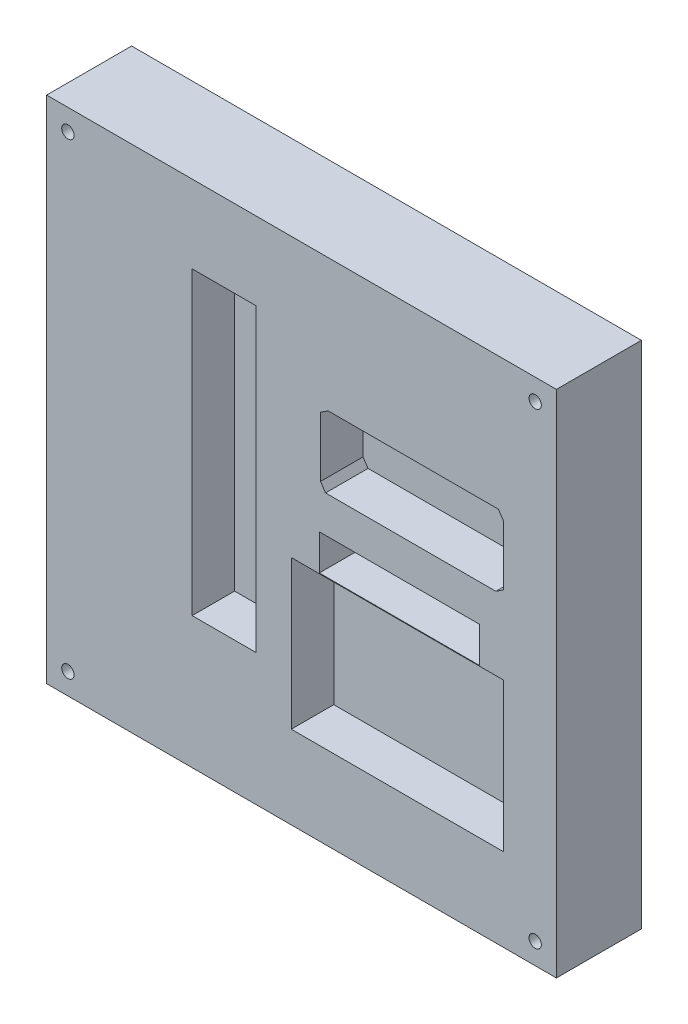
from build123d import *

# Parameters (mm, degrees)
SKETCH1_W           = 120
SKETCH1_H           = 120
BOSS_EXTRUDE1_DEPTH = 3
SKETCH1_3_W         = 120
SKETCH1_3_H         = 120
SKETCH1_3_R         = 1.45
SKETCH1_3_W_2       = 100
SKETCH1_3_H_2       = 100
BOSS_EXTRUDE2_DEPTH = 10
BOSS_EXTRUDE3_START = 10
SKETCH5_W           = 120
SKETCH5_H           = 120
SKETCH5_R           = 1.45
SKETCH5_W_2         = 70.699570221
SKETCH5_H_2         = 15
SKETCH5_W_3         = 35
SKETCH5_H_3         = 50
SKETCH5_W_4         = 8.3907815
SKETCH5_H_4         = 37.710608616
BOSS_EXTRUDE3_DEPTH = 10


with BuildPart() as part:
    # Sketch1 → Boss-Extrude1 (new body)
    with BuildSketch(Plane(origin=(0, 0, 0), x_dir=(0, 1, 0), z_dir=(0, 0, 1))):
        Rectangle(SKETCH1_W, SKETCH1_H)
    extrude(amount=BOSS_EXTRUDE1_DEPTH)

    # Sketch1<3> → Boss-Extrude2 (add)
    # profile 1 of 3: a face of its own
    with BuildSketch(Plane(origin=(0, 0, 0), x_dir=(0, 1, 0), z_dir=(0, 0, 1))):
        Rectangle(SKETCH1_3_W, SKETCH1_3_H)
        with Locations(Location((-55, -55, 0), (0, 0, 270))):
            Circle(SKETCH1_3_R, mode=Mode.SUBTRACT)
        with Locations(Location((-55, 55, 0), (0, 0, 90))):
            Circle(SKETCH1_3_R, mode=Mode.SUBTRACT)
        with Locations(Location((55, -55, 0), (0, 0, 90))):
            Circle(SKETCH1_3_R, mode=Mode.SUBTRACT)
        with Locations(Location((55, 55, 0), (0, 0, 270))):
            Circle(SKETCH1_3_R, mode=Mode.SUBTRACT)
        Rectangle(SKETCH1_3_W_2, SKETCH1_3_H_2, mode=Mode.SUBTRACT)
    # profile 2 of 3: a face of its own
    with BuildSketch(Plane(origin=(0, 0, 0), x_dir=(0, 1, 0), z_dir=(0, 0, 1))):
        with Locations(Location((42.5, 1.5, 0), (0, 0, 270))):
            Circle(SKETCH1_3_R)
    # profile 3 of 3: a face of its own
    with BuildSketch(Plane(origin=(0, 0, 0), x_dir=(0, 1, 0), z_dir=(0, 0, 1))):
        with Locations(Location((-46, -46, 0), (0, 0, 270))):
            Circle(SKETCH1_3_R)
    extrude(amount=BOSS_EXTRUDE2_DEPTH)

    # Sketch5 → Boss-Extrude3 (add)
    with BuildSketch(Plane(origin=(0, 0, 0), x_dir=(0, 1, 0), z_dir=(0, 0, 1)).offset(BOSS_EXTRUDE3_START)):
        Rectangle(SKETCH5_W, SKETCH5_H)
        with Locations(Location((-55, -55, 0), (0, 0, 270))):
            Circle(SKETCH5_R, mode=Mode.SUBTRACT)
        with Locations(Location((-55, 55, 0), (0, 0, 270))):
            Circle(SKETCH5_R, mode=Mode.SUBTRACT)
        with Locations(Location((55, -55, 0), (0, 0, 270))):
            Circle(SKETCH5_R, mode=Mode.SUBTRACT)
        with Locations(Location((55, 55, 0), (0, 0, 270))):
            Circle(SKETCH5_R, mode=Mode.SUBTRACT)
        with Locations((6.34978511, 18.25)):
            Rectangle(SKETCH5_W_2, SKETCH5_H_2, mode=Mode.SUBTRACT)
        with Locations((-22.982605132, -22.59)):
            Rectangle(SKETCH5_W_3, SKETCH5_H_3, mode=Mode.SUBTRACT)
        with Locations((-1.13563625, -23.044910308)):
            Rectangle(SKETCH5_W_4, SKETCH5_H_4, mode=Mode.SUBTRACT)
        Polygon((27.574081379, -4.481691375), (28.750030367, -6.241709633), (28.748424488, -46.344003965), (26.988191952, -47.520096123), (12.885918621, -47.518308625), (11.709969633, -45.758290367), (11.711575511, -5.655996035), (13.471808048, -4.479903877), align=None, mode=Mode.SUBTRACT)
    extrude(amount=BOSS_EXTRUDE3_DEPTH)


solid = part.part
